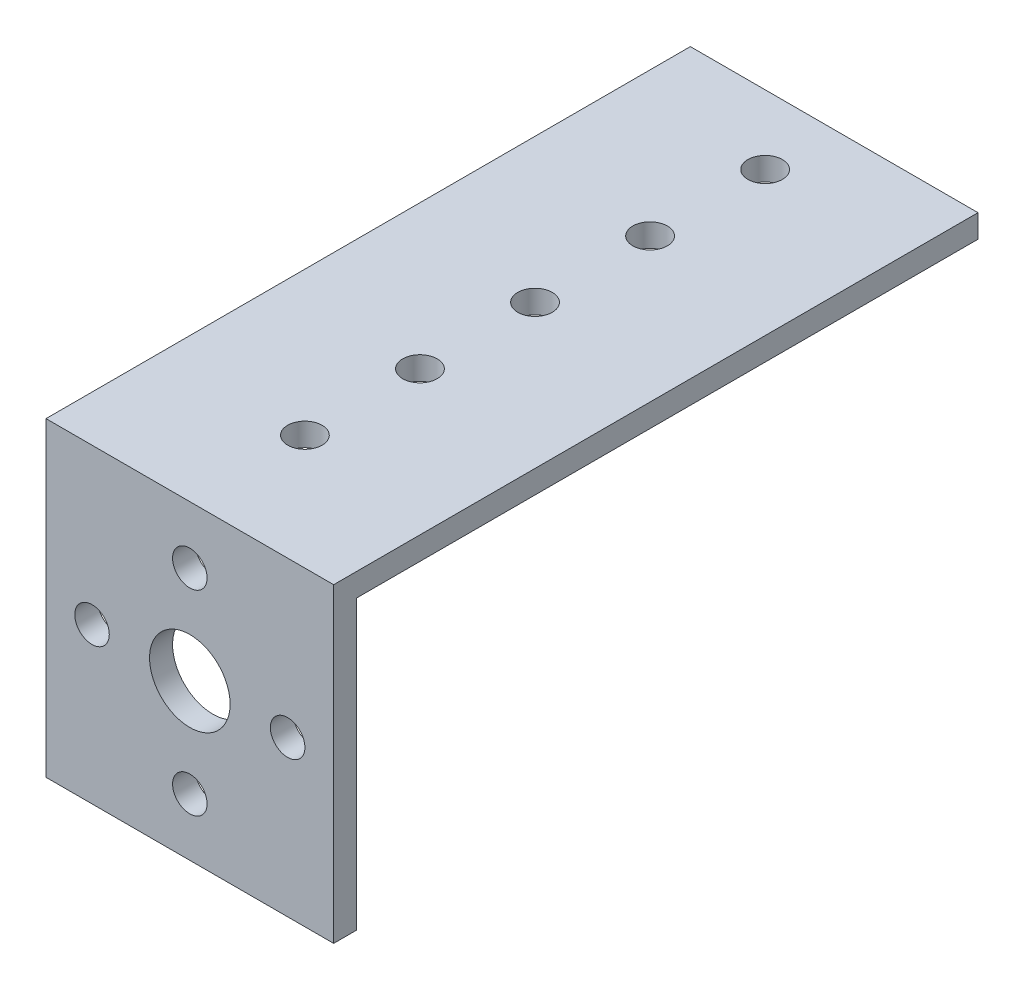
from build123d import *

# Parameters (mm, degrees)
BOSS_EXTRUDE1_DEPTH = 25
SKETCH2_R           = 1.5
SKETCH2_R_2         = 3.5
CUT_EXTRUDE1_DEPTH  = 25
SKETCH3_R           = 1.5
CUT_EXTRUDE2_DEPTH  = 25


with BuildPart() as part:
    # Sketch1 → Boss-Extrude1 (new body)
    with BuildSketch(Plane(origin=(0, 0, 0), x_dir=(0, 0, -1), z_dir=(1, 0, 0))):
        Polygon((0, 0), (0, 27), (56, 27), (56, 25), (2, 25), (2, 0), align=None)
    extrude(amount=BOSS_EXTRUDE1_DEPTH)

    # Sketch2 → Cut-Extrude1 (cut)
    with BuildSketch(Plane.XY):
        with Locations((4, 13.5)):
            Circle(SKETCH2_R)
        with Locations((12.5, 13.5)):
            Circle(SKETCH2_R_2)
        with Locations((12.5, 22)):
            Circle(SKETCH2_R)
        with Locations((21, 13.5)):
            Circle(SKETCH2_R)
        with Locations((12.5, 5)):
            Circle(SKETCH2_R)
    extrude(amount=-CUT_EXTRUDE1_DEPTH, mode=Mode.SUBTRACT)

    # Sketch3 → Cut-Extrude2 (cut)
    with BuildSketch(Plane(origin=(0, 27, 0), x_dir=(1, 0, 0), z_dir=(0, 1, 0))):
        with Locations(Location((12.5, 10, 0), (0, 0, 270))):
            Circle(SKETCH3_R)
        with Locations(Location((12.5, 20, 0), (0, 0, 270))):
            Circle(SKETCH3_R)
        with Locations(Location((12.5, 30, 0), (0, 0, 270))):
            Circle(SKETCH3_R)
        with Locations(Location((12.5, 40, 0), (0, 0, 270))):
            Circle(SKETCH3_R)
        with Locations(Location((12.5, 50, 0), (0, 0, 270))):
            Circle(SKETCH3_R)
    extrude(amount=-CUT_EXTRUDE2_DEPTH, mode=Mode.SUBTRACT)


solid = part.part
